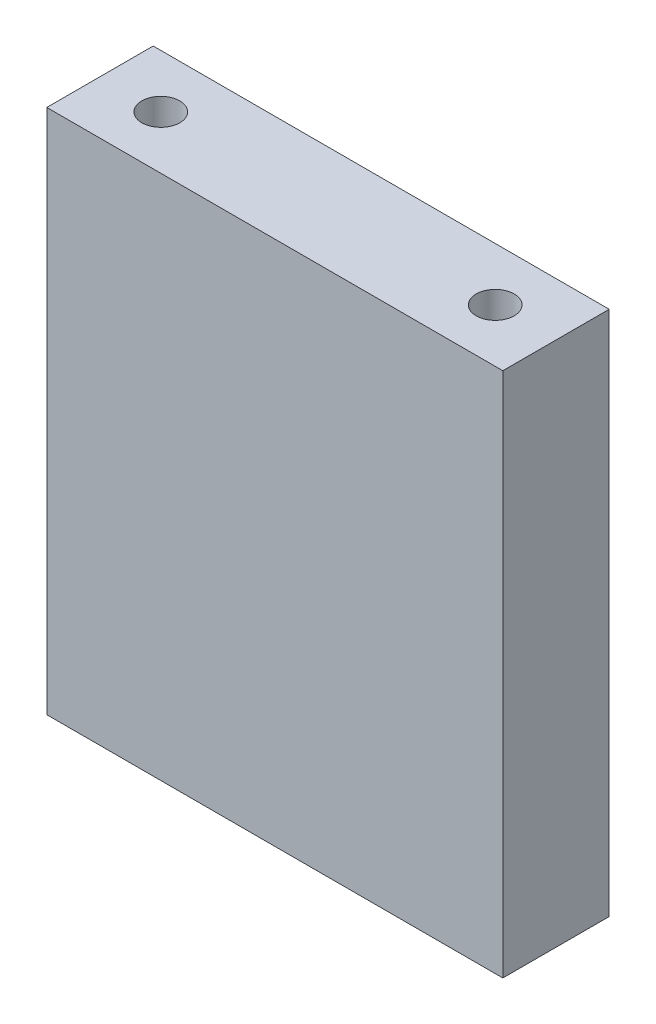
from build123d import *

# Parameters (mm, degrees)
SKETCH_1_W          = 30
SKETCH_1_H          = 34.6
EXTRUDE_1_DEPTH     = 7
SKETCH_2_R          = 1.25
CUT_EXTRUDE_1_DEPTH = 47.326666187


with BuildPart() as part:
    # Эскиз1 → Бобышка-Вытянуть1 (new body)
    with BuildSketch(Plane.XY):
        with Locations((15, 17.3)):
            Rectangle(SKETCH_1_W, SKETCH_1_H)
    extrude(amount=EXTRUDE_1_DEPTH)

    # Эскиз2 → Вырез-Вытянуть1 (cut, through all)
    with BuildSketch(Plane(origin=(0, 34.6, 0), x_dir=(1, 0, 0), z_dir=(0, 1, 0))):
        with Locations(Location((4, -3.5, 0), (0, 0, 270))):
            Circle(SKETCH_2_R)
        with Locations(Location((26, -3.5, 0), (0, 0, 270))):
            Circle(SKETCH_2_R)
    extrude(amount=-CUT_EXTRUDE_1_DEPTH, mode=Mode.SUBTRACT)


solid = part.part
